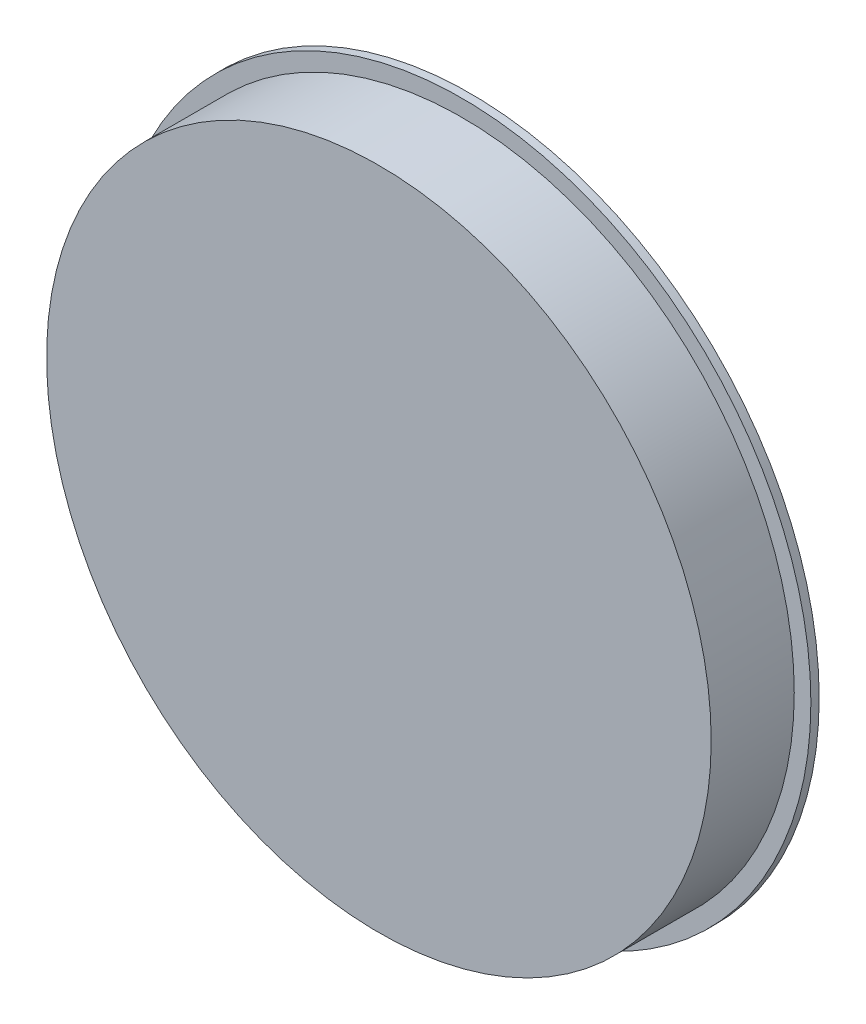
from build123d import *

# Parameters (mm, degrees)
SKETCH1_R           = 12.5
BOSS_EXTRUDE1_DEPTH = 3.175
SKETCH2_R           = 42
BOSS_EXTRUDE2_DEPTH = 1
SKETCH3_R           = 40
BOSS_EXTRUDE3_DEPTH = 10


with BuildPart() as part:
    # Sketch1 → Boss-Extrude1 (new body)
    with BuildSketch(Plane.XY):
        Circle(SKETCH1_R)
    extrude(amount=-BOSS_EXTRUDE1_DEPTH)

    # Sketch2 → Boss-Extrude2 (add)
    with BuildSketch(Plane.XY):
        Circle(SKETCH2_R)
    extrude(amount=BOSS_EXTRUDE2_DEPTH)

    # Sketch3 → Boss-Extrude3 (add)
    with BuildSketch(Plane.XY.offset(1)):
        Circle(SKETCH3_R)
    extrude(amount=BOSS_EXTRUDE3_DEPTH)


solid = part.part
